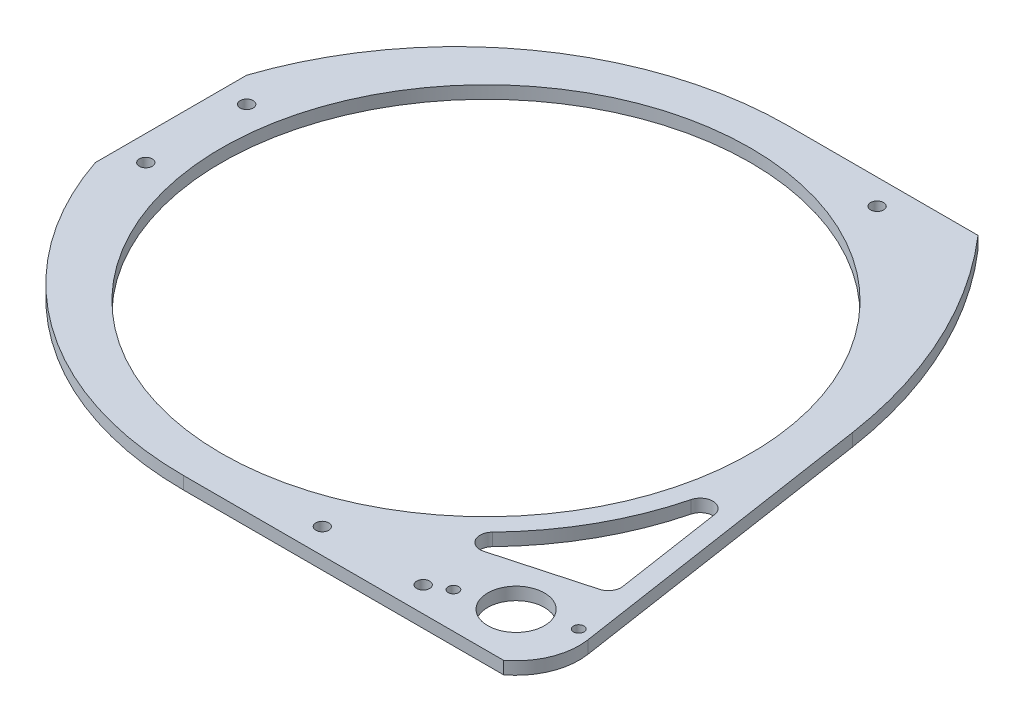
from build123d import *

# Parameters (mm, degrees)
SKETCH1_R           = 3.2639
SKETCH1_R_2         = 133.223
SKETCH1_R_3         = 2.6289
SKETCH1_R_4         = 14.2875
BOSS_EXTRUDE1_DEPTH = 6.35
CUT_EXTRUDE1_DEPTH  = 6.35
FILLET1_R           = 6.35


with BuildPart() as part:
    # Sketch1 → Boss-Extrude1 (new body)
    with BuildSketch(Plane(origin=(0, 0, 0), x_dir=(1, 0, 0), z_dir=(0, 1, 0))):
        with BuildLine():
            Line((95.377, 152.4), (0, 152.4))
            ThreePointArc((0, 152.4), (-97.757028045, 120.848293921), (-158.623, 38.1))
            Line((-158.623, 38.1), (-158.623, -38.1))
            ThreePointArc((-158.623, -38.1), (-97.757028045, -120.848293921), (0, -152.4))
            Line((0, -152.4), (161.207253597, -152.4))
            ThreePointArc((161.207253597, -152.4), (171.540803487, -139.027863312), (173.54963847, -122.24808754))
            Line((173.54963847, -122.24808754), (149.785027389, 34.747190404))
            ThreePointArc((149.785027389, 34.747190404), (130.958683739, 97.447812085), (95.377, 152.4))
        make_face()
        with Locations(Location((108.077, -139.7, 0), (0, 0, 270))):
            Circle(SKETCH1_R, mode=Mode.SUBTRACT)
        with Locations(Location((-145.923, -25.4, 0), (0, 0, 270))):
            Circle(SKETCH1_R, mode=Mode.SUBTRACT)
        with Locations(Location((0, 0, 0), (0, 0, 270))):
            Circle(SKETCH1_R_2, mode=Mode.SUBTRACT)
        with Locations(Location((57.277, -139.7, 0), (0, 0, 270))):
            Circle(SKETCH1_R, mode=Mode.SUBTRACT)
        with Locations(Location((-145.923, 25.4, 0), (0, 0, 270))):
            Circle(SKETCH1_R, mode=Mode.SUBTRACT)
        with Locations(Location((57.277, 139.7, 0), (0, 0, 270))):
            Circle(SKETCH1_R, mode=Mode.SUBTRACT)
        with Locations(Location((166.516908963, -119.805057995, 0), (0, 0, 270))):
            Circle(SKETCH1_R_3, mode=Mode.SUBTRACT)
        with Locations(Location((117.797598231, -134.194942005, 0), (0, 0, 270))):
            Circle(SKETCH1_R_3, mode=Mode.SUBTRACT)
        with Locations(Location((142.157253597, -127, 0), (0, 0, 270))):
            Circle(SKETCH1_R_4, mode=Mode.SUBTRACT)
    extrude(amount=BOSS_EXTRUDE1_DEPTH)

    # Sketch2 → Cut-Extrude1 (cut)
    with BuildSketch(Plane(origin=(0, 6.35, 0), x_dir=(1, 0, 0), z_dir=(0, 1, 0))):
        with BuildLine():
            Line((81.096337026, -117.475), (159.907199476, -95.764025273))
            Line((159.907199476, -95.764025273), (142.748, 17.594164432))
            Line((142.748, 17.594164432), (142.748, 0))
            ThreePointArc((142.748, 0), (126.398835876, -66.33495152), (81.096337026, -117.475))
        make_face()
    extrude(amount=-CUT_EXTRUDE1_DEPTH, mode=Mode.SUBTRACT)

    # Fillet1
    fillet1_edges = [part.edges().sort_by_distance(p)[0] for p in [
        (81.096337026, 3.175, 117.475),
        (142.748, 3.175, -17.594164432),
        (159.907199476, 3.175, 95.764025273),
    ]]
    fillet(fillet1_edges, radius=FILLET1_R)


solid = part.part
